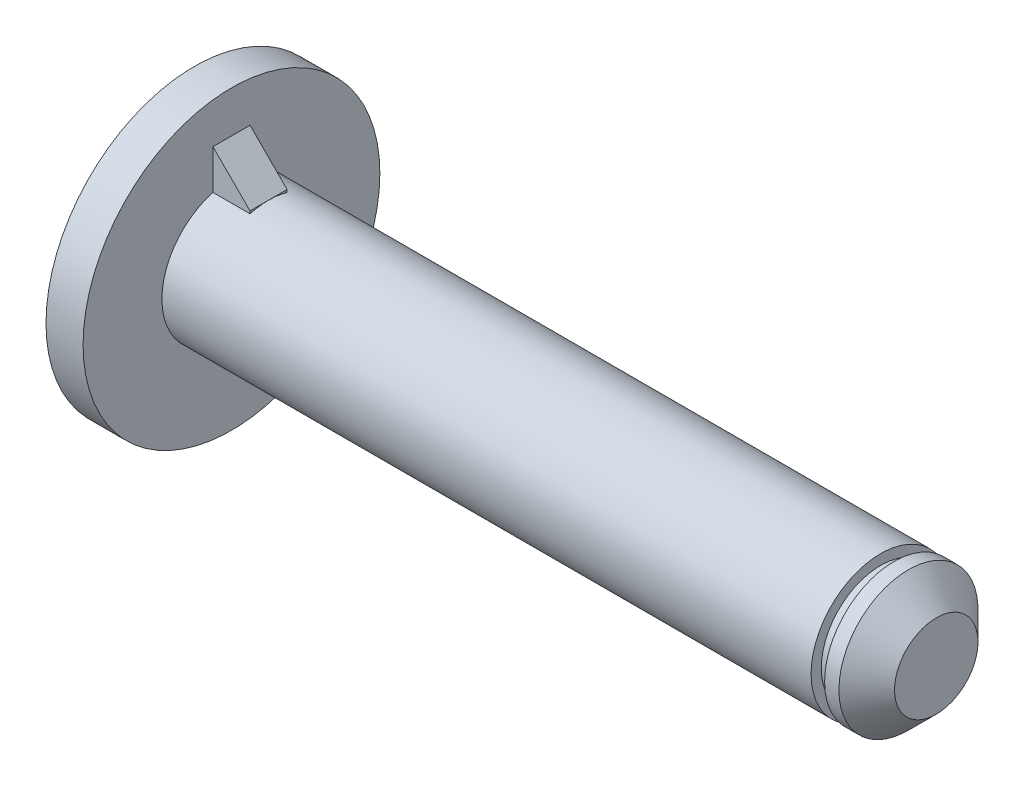
from build123d import *

# Parameters (mm, degrees)
RIB_DEPTH     = 1
CHAMFER1_SIZE = 1.5


with BuildPart() as part:
    # Sketch1 → Main Body (revolve)
    with BuildSketch(Plane.XY, mode=Mode.PRIVATE) as main_body_sk:
        Polygon((-20, 0), (-20, 8), (-18, 8), (-18, 3.75), (17, 3.75), (17, 3.2), (17.73, 3.2), (17.73, 3.75), (20, 3.75), (20, 0), align=None)
    revolve(main_body_sk.sketch.rotate(Axis((-20, 0, 0), (1, 0, 0)), 90), axis=Axis((-20, 0, 0), (1, 0, 0)))

    # Sketch2 → Rib (add, symmetric)
    with BuildSketch(Plane.XY):
        Polygon((-18, 5.75), (-16, 3.75), (-16, 2.75), (-19, 2.75), (-19, 5.75), align=None)
    extrude(amount=RIB_DEPTH, both=True)

    # Chamfer1
    chamfer1_edges = [part.edges().sort_by_distance(p)[0] for p in [
        (20, 0, -3.75),
    ]]
    chamfer(chamfer1_edges, length=CHAMFER1_SIZE)


solid = part.part
